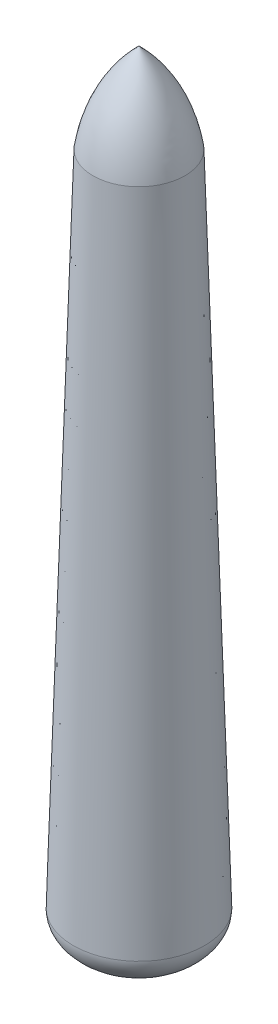
from build123d import *


with BuildPart() as part:
    # Sketch2 one side → Revolve1 (revolve)
    with BuildSketch(Plane(origin=(0, 0, 0), x_dir=(0, 0, -1), z_dir=(1, 0, 0))):
        with BuildLine():
            add(Edge.make_bspline(
                [(-25, -12), (-31.144124528, -12), (-32.596824153, -14.290688388)],
                knots=[4.71238898, 4.71238898, 4.71238898, 6.044487862, 6.044487862, 6.044487862], degree=2, weights=[1, 0.786268785, 1]))
            Line((-25, -12), (-25, 250))
            Line((-25, 250), (-25, 284.024444444))
            add(Edge.make_bspline(
                [(-42.5, 250), (-39.550338865, 270.024077661), (-25, 284.024444444)],
                knots=[0, 0, 0, 1, 1, 1], degree=2))
            Line((-42.5, 250), (-50, 0))
            add(Edge.make_bspline(
                [(-50, 0), (-50, -10.960184588), (-32.596824153, -14.290688388)],
                knots=[0, 0, 0, 1.262041095, 1.262041095, 1.262041095], degree=2, weights=[1, 0.807425837, 1]))
        make_face()
    revolve(axis=Axis((0, 250, 25), (0, -1, 0)))


solid = part.part
